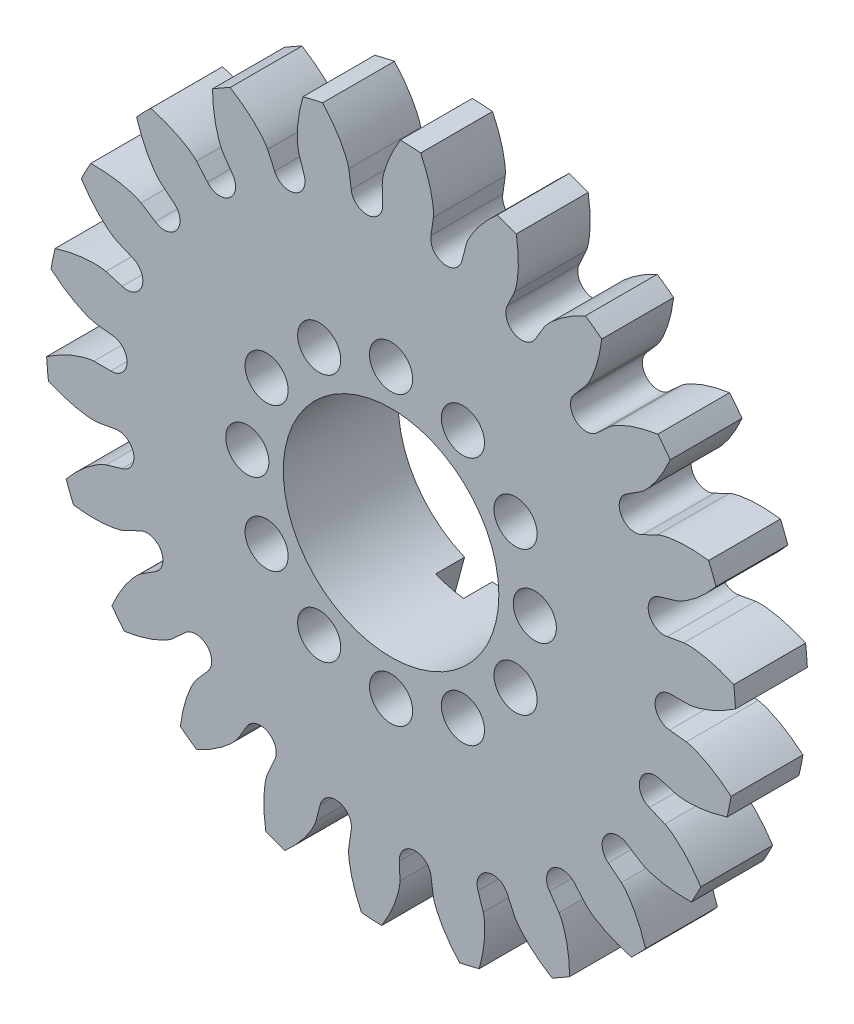
from build123d import *

# Parameters (mm, degrees)
SKETCH_1_W               = 5
SKETCH_1_H               = 10
SKETCH_6_R               = 24
SKETCH_6_R_2             = 17.5
EXTRUDE_1_DEPTH          = 5
CUT_EXTRUDE_2_DEPTH      = 35.307433597
PATTERN_CIRCULAR_1_COUNT = 22
MIRROR_1_COPY_1_DEPTH    = 35.307433597
MIRROR_1_COPY_2_DEPTH    = 35.307433597
MIRROR_1_COPY_3_DEPTH    = 35.307433597
MIRROR_1_COPY_4_DEPTH    = 35.307433597
MIRROR_1_COPY_5_DEPTH    = 35.307433597
MIRROR_1_COPY_6_DEPTH    = 35.307433597
MIRROR_1_COPY_7_DEPTH    = 35.307433597
MIRROR_1_COPY_8_DEPTH    = 35.307433597
MIRROR_1_COPY_9_DEPTH    = 35.307433597
MIRROR_1_COPY_10_DEPTH   = 35.307433597
MIRROR_1_COPY_11_DEPTH   = 35.307433597
MIRROR_1_COPY_12_DEPTH   = 35.307433597
MIRROR_1_COPY_13_DEPTH   = 35.307433597
MIRROR_1_COPY_14_DEPTH   = 35.307433597
MIRROR_1_COPY_15_DEPTH   = 35.307433597
MIRROR_1_COPY_16_DEPTH   = 35.307433597
MIRROR_1_COPY_17_DEPTH   = 35.307433597
MIRROR_1_COPY_18_DEPTH   = 35.307433597
MIRROR_1_COPY_19_DEPTH   = 35.307433597
MIRROR_1_COPY_20_DEPTH   = 35.307433597
MIRROR_1_COPY_21_DEPTH   = 35.307433597
SKETCH_8_R               = 1.101508708
CUT_EXTRUDE_3_DEPTH      = 35.274127733
PATTERN_CIRCULAR_2_COUNT = 22
EXTRUDE_START            = 3
SKETCH_10_R              = 12.5
SKETCH_10_R_2            = 7.5
EXTRUDE_2_DEPTH          = 3
SKETCH_11_R              = 1.5
CUT_EXTRUDE_5_DEPTH      = 35.838424632
SKETCH_12_R              = 16.5
SKETCH_12_R_2            = 12.5
CUT_EXTRUDE_6_DEPTH      = 3
CUT_EXTRUDE_7_DEPTH      = 2


with BuildPart() as part:
    # ｽｹｯﾁ1 → 回転1 (revolve)
    with BuildSketch(Plane(origin=(0, 0, 0), x_dir=(0, 0, -1), z_dir=(1, 0, 0)), mode=Mode.PRIVATE) as revolve_1_sk:
        with Locations((2.5, 12.5)):
            Rectangle(SKETCH_1_W, SKETCH_1_H)
    revolve(revolve_1_sk.sketch.rotate(Axis((0, 0, 0), (0, 0, -1)), 90), axis=Axis((0, 0, 0), (0, 0, -1)))

    # ｽｹｯﾁ6 → ﾎﾞｽ - 押し出し1 (add, through all)
    with BuildSketch(Plane.XY):
        Circle(SKETCH_6_R)
        Circle(SKETCH_6_R_2, mode=Mode.SUBTRACT)
    extrude(amount=-EXTRUDE_1_DEPTH)

    # ｽｹｯﾁ7 → ｶｯﾄ - 押し出し2 (cut, through all)
    with BuildSketch(Plane.XY):
        with BuildLine():
            Line((19.5, 0), (20.673237657, 0))
            add(Edge.make_bspline(
                [(20.673237657, 0), (20.705097618, 0.001016279), (20.76868666, 0.004953572), (20.946306576, 0.025954943), (21.280946336, 0.091618095), (21.783663359, 0.236162746), (22.452216157, 0.500283619), (23.095599061, 0.825426896), (23.575034854, 1.111479717), (23.863802108, 1.299385731), (23.961177482, 1.364541562)],
                knots=[0, 0, 0, 0, 0, 0.002802036, 0.005604071, 0.015718253, 0.029959921, 0.048733673, 0.068727069, 0.079031375, 0.079031375, 0.079031375, 0.079031375, 0.079031375], degree=4))
            ThreePointArc((23.961177482, 1.364541562), (23.99999954, 0.004697234), (23.961709777, -1.355162186))
            Line((23.961709777, -1.355162186), (19.468889194, -1.101069276))
            ThreePointArc((19.468889194, -1.101069276), (19.492220747, -0.550754354), (19.5, 0))
        make_face()
    cut_extrude_2 = extrude(amount=-CUT_EXTRUDE_2_DEPTH, mode=Mode.SUBTRACT)

    # 円形ﾊﾟﾀｰﾝ1: ｶｯﾄ - 押し出し2 ×22 about axis
    pattern_circular_1_axis = Axis((0, 0, 0), (0, 0, 1))
    for i in range(1, PATTERN_CIRCULAR_1_COUNT):
        add(cut_extrude_2.rotate(pattern_circular_1_axis, i * 360 / PATTERN_CIRCULAR_1_COUNT), mode=Mode.SUBTRACT)

    # ﾐﾗｰ1: ｶｯﾄ - 押し出し2 across plane
    add(cut_extrude_2.mirror(Plane(origin=(19.468889194, -1.101069276, -5), x_dir=(0, 0, 1), z_dir=(-0.05646509109013372, -0.9984045740521139, 0))), mode=Mode.SUBTRACT)

    # ﾐﾗｰ1 copy 1 sketch → ﾐﾗｰ1 copy 1 (cut, through all)
    with BuildSketch(Plane(origin=(0, 0, 0), x_dir=(0.9216093094984582, -0.38811890013986033, 0), z_dir=(0, 0, 1))):
        with BuildLine():
            Line((19.5, 0), (20.673237657, 0))
            add(Edge.make_bspline(
                [(20.673237657, 0), (20.705097618, -0.001016279), (20.76868666, -0.004953572), (20.946306576, -0.025954943), (21.280946336, -0.091618095), (21.783663359, -0.236162746), (22.452216157, -0.500283619), (23.095599061, -0.825426896), (23.575034854, -1.111479717), (23.863802108, -1.299385731), (23.961177482, -1.364541562)],
                knots=[0, 0, 0, 0, 0, 0.002802036, 0.005604071, 0.015718253, 0.029959921, 0.048733673, 0.068727069, 0.079031375, 0.079031375, 0.079031375, 0.079031375, 0.079031375], degree=4))
            ThreePointArc((23.961177482, -1.364541562), (23.99999954, -0.004697234), (23.961709777, 1.355162186))
            Line((23.961709777, 1.355162186), (19.468889194, 1.101069276))
            ThreePointArc((19.468889194, 1.101069276), (19.492220747, 0.550754354), (19.5, 0))
        make_face()
    extrude(amount=-MIRROR_1_COPY_1_DEPTH, mode=Mode.SUBTRACT)

    # ﾐﾗｰ1 copy 2 sketch → ﾐﾗｰ1 copy 2 (cut, through all)
    with BuildSketch(Plane(origin=(0, 0, 0), x_dir=(0.7749319267865931, -0.632044704785048, 0), z_dir=(0, 0, 1))):
        with BuildLine():
            Line((19.5, 0), (20.673237657, 0))
            add(Edge.make_bspline(
                [(20.673237657, 0), (20.705097618, -0.001016279), (20.76868666, -0.004953572), (20.946306576, -0.025954943), (21.280946336, -0.091618095), (21.783663359, -0.236162746), (22.452216157, -0.500283619), (23.095599061, -0.825426896), (23.575034854, -1.111479717), (23.863802108, -1.299385731), (23.961177482, -1.364541562)],
                knots=[0, 0, 0, 0, 0, 0.002802036, 0.005604071, 0.015718253, 0.029959921, 0.048733673, 0.068727069, 0.079031375, 0.079031375, 0.079031375, 0.079031375, 0.079031375], degree=4))
            ThreePointArc((23.961177482, -1.364541562), (23.99999954, -0.004697234), (23.961709777, 1.355162186))
            Line((23.961709777, 1.355162186), (19.468889194, 1.101069276))
            ThreePointArc((19.468889194, 1.101069276), (19.492220747, 0.550754354), (19.5, 0))
        make_face()
    extrude(amount=-MIRROR_1_COPY_2_DEPTH, mode=Mode.SUBTRACT)

    # ﾐﾗｰ1 copy 3 sketch → ﾐﾗｰ1 copy 3 (cut, through all)
    with BuildSketch(Plane(origin=(0, 0, 0), x_dir=(0.5654741680641019, -0.8247660063631453, 0), z_dir=(0, 0, 1))):
        with BuildLine():
            Line((19.5, 0), (20.673237657, 0))
            add(Edge.make_bspline(
                [(20.673237657, 0), (20.705097618, -0.001016279), (20.76868666, -0.004953572), (20.946306576, -0.025954943), (21.280946336, -0.091618095), (21.783663359, -0.236162746), (22.452216157, -0.500283619), (23.095599061, -0.825426896), (23.575034854, -1.111479717), (23.863802108, -1.299385731), (23.961177482, -1.364541562)],
                knots=[0, 0, 0, 0, 0, 0.002802036, 0.005604071, 0.015718253, 0.029959921, 0.048733673, 0.068727069, 0.079031375, 0.079031375, 0.079031375, 0.079031375, 0.079031375], degree=4))
            ThreePointArc((23.961177482, -1.364541562), (23.99999954, -0.004697234), (23.961709777, 1.355162186))
            Line((23.961709777, 1.355162186), (19.468889194, 1.101069276))
            ThreePointArc((19.468889194, 1.101069276), (19.492220747, 0.550754354), (19.5, 0))
        make_face()
    extrude(amount=-MIRROR_1_COPY_3_DEPTH, mode=Mode.SUBTRACT)

    # ﾐﾗｰ1 copy 4 sketch → ﾐﾗｰ1 copy 4 (cut, through all)
    with BuildSketch(Plane(origin=(0, 0, 0), x_dir=(0.3102050552494255, -0.9506696711780076, 0), z_dir=(0, 0, 1))):
        with BuildLine():
            Line((19.5, 0), (20.673237657, 0))
            add(Edge.make_bspline(
                [(20.673237657, 0), (20.705097618, -0.001016279), (20.76868666, -0.004953572), (20.946306576, -0.025954943), (21.280946336, -0.091618095), (21.783663359, -0.236162746), (22.452216157, -0.500283619), (23.095599061, -0.825426896), (23.575034854, -1.111479717), (23.863802108, -1.299385731), (23.961177482, -1.364541562)],
                knots=[0, 0, 0, 0, 0, 0.002802036, 0.005604071, 0.015718253, 0.029959921, 0.048733673, 0.068727069, 0.079031375, 0.079031375, 0.079031375, 0.079031375, 0.079031375], degree=4))
            ThreePointArc((23.961177482, -1.364541562), (23.99999954, -0.004697234), (23.961709777, 1.355162186))
            Line((23.961709777, 1.355162186), (19.468889194, 1.101069276))
            ThreePointArc((19.468889194, 1.101069276), (19.492220747, 0.550754354), (19.5, 0))
        make_face()
    extrude(amount=-MIRROR_1_COPY_4_DEPTH, mode=Mode.SUBTRACT)

    # ﾐﾗｰ1 copy 5 sketch → ﾐﾗｰ1 copy 5 (cut, through all)
    with BuildSketch(Plane(origin=(0, 0, 0), x_dir=(0.029804973718939642, -0.9995557330842606, 0), z_dir=(0, 0, 1))):
        with BuildLine():
            Line((19.5, 0), (20.673237657, 0))
            add(Edge.make_bspline(
                [(20.673237657, 0), (20.705097618, -0.001016279), (20.76868666, -0.004953572), (20.946306576, -0.025954943), (21.280946336, -0.091618095), (21.783663359, -0.236162746), (22.452216157, -0.500283619), (23.095599061, -0.825426896), (23.575034854, -1.111479717), (23.863802108, -1.299385731), (23.961177482, -1.364541562)],
                knots=[0, 0, 0, 0, 0, 0.002802036, 0.005604071, 0.015718253, 0.029959921, 0.048733673, 0.068727069, 0.079031375, 0.079031375, 0.079031375, 0.079031375, 0.079031375], degree=4))
            ThreePointArc((23.961177482, -1.364541562), (23.99999954, -0.004697234), (23.961709777, 1.355162186))
            Line((23.961709777, 1.355162186), (19.468889194, 1.101069276))
            ThreePointArc((19.468889194, 1.101069276), (19.492220747, 0.550754354), (19.5, 0))
        make_face()
    extrude(amount=-MIRROR_1_COPY_5_DEPTH, mode=Mode.SUBTRACT)

    # ﾐﾗｰ1 copy 6 sketch → ﾐﾗｰ1 copy 6 (cut, through all)
    with BuildSketch(Plane(origin=(0, 0, 0), x_dir=(-0.25300972952525125, -0.9674637340828645, 0), z_dir=(0, 0, 1))):
        with BuildLine():
            Line((19.5, 0), (20.673237657, 0))
            add(Edge.make_bspline(
                [(20.673237657, 0), (20.705097618, -0.001016279), (20.76868666, -0.004953572), (20.946306576, -0.025954943), (21.280946336, -0.091618095), (21.783663359, -0.236162746), (22.452216157, -0.500283619), (23.095599061, -0.825426896), (23.575034854, -1.111479717), (23.863802108, -1.299385731), (23.961177482, -1.364541562)],
                knots=[0, 0, 0, 0, 0, 0.002802036, 0.005604071, 0.015718253, 0.029959921, 0.048733673, 0.068727069, 0.079031375, 0.079031375, 0.079031375, 0.079031375, 0.079031375], degree=4))
            ThreePointArc((23.961177482, -1.364541562), (23.99999954, -0.004697234), (23.961709777, 1.355162186))
            Line((23.961709777, 1.355162186), (19.468889194, 1.101069276))
            ThreePointArc((19.468889194, 1.101069276), (19.492220747, 0.550754354), (19.5, 0))
        make_face()
    extrude(amount=-MIRROR_1_COPY_6_DEPTH, mode=Mode.SUBTRACT)

    # ﾐﾗｰ1 copy 7 sketch → ﾐﾗｰ1 copy 7 (cut, through all)
    with BuildSketch(Plane(origin=(0, 0, 0), x_dir=(-0.5153270891901053, -0.8569935770744456, 0), z_dir=(0, 0, 1))):
        with BuildLine():
            Line((19.5, 0), (20.673237657, 0))
            add(Edge.make_bspline(
                [(20.673237657, 0), (20.705097618, -0.001016279), (20.76868666, -0.004953572), (20.946306576, -0.025954943), (21.280946336, -0.091618095), (21.783663359, -0.236162746), (22.452216157, -0.500283619), (23.095599061, -0.825426896), (23.575034854, -1.111479717), (23.863802108, -1.299385731), (23.961177482, -1.364541562)],
                knots=[0, 0, 0, 0, 0, 0.002802036, 0.005604071, 0.015718253, 0.029959921, 0.048733673, 0.068727069, 0.079031375, 0.079031375, 0.079031375, 0.079031375, 0.079031375], degree=4))
            ThreePointArc((23.961177482, -1.364541562), (23.99999954, -0.004697234), (23.961709777, 1.355162186))
            Line((23.961709777, 1.355162186), (19.468889194, 1.101069276))
            ThreePointArc((19.468889194, 1.101069276), (19.492220747, 0.550754354), (19.5, 0))
        make_face()
    extrude(amount=-MIRROR_1_COPY_7_DEPTH, mode=Mode.SUBTRACT)

    # ﾐﾗｰ1 copy 8 sketch → ﾐﾗｰ1 copy 8 (cut, through all)
    with BuildSketch(Plane(origin=(0, 0, 0), x_dir=(-0.7358957128569837, -0.6770948971885048, 0), z_dir=(0, 0, 1))):
        with BuildLine():
            Line((19.5, 0), (20.673237657, 0))
            add(Edge.make_bspline(
                [(20.673237657, 0), (20.705097618, -0.001016279), (20.76868666, -0.004953572), (20.946306576, -0.025954943), (21.280946336, -0.091618095), (21.783663359, -0.236162746), (22.452216157, -0.500283619), (23.095599061, -0.825426896), (23.575034854, -1.111479717), (23.863802108, -1.299385731), (23.961177482, -1.364541562)],
                knots=[0, 0, 0, 0, 0, 0.002802036, 0.005604071, 0.015718253, 0.029959921, 0.048733673, 0.068727069, 0.079031375, 0.079031375, 0.079031375, 0.079031375, 0.079031375], degree=4))
            ThreePointArc((23.961177482, -1.364541562), (23.99999954, -0.004697234), (23.961709777, 1.355162186))
            Line((23.961709777, 1.355162186), (19.468889194, 1.101069276))
            ThreePointArc((19.468889194, 1.101069276), (19.492220747, 0.550754354), (19.5, 0))
        make_face()
    extrude(amount=-MIRROR_1_COPY_8_DEPTH, mode=Mode.SUBTRACT)

    # ﾐﾗｰ1 copy 9 sketch → ﾐﾗｰ1 copy 9 (cut, through all)
    with BuildSketch(Plane(origin=(0, 0, 0), x_dir=(-0.8968464424085102, -0.44234201557075603, 0), z_dir=(0, 0, 1))):
        with BuildLine():
            Line((19.5, 0), (20.673237657, 0))
            add(Edge.make_bspline(
                [(20.673237657, 0), (20.705097618, -0.001016279), (20.76868666, -0.004953572), (20.946306576, -0.025954943), (21.280946336, -0.091618095), (21.783663359, -0.236162746), (22.452216157, -0.500283619), (23.095599061, -0.825426896), (23.575034854, -1.111479717), (23.863802108, -1.299385731), (23.961177482, -1.364541562)],
                knots=[0, 0, 0, 0, 0, 0.002802036, 0.005604071, 0.015718253, 0.029959921, 0.048733673, 0.068727069, 0.079031375, 0.079031375, 0.079031375, 0.079031375, 0.079031375], degree=4))
            ThreePointArc((23.961177482, -1.364541562), (23.99999954, -0.004697234), (23.961709777, 1.355162186))
            Line((23.961709777, 1.355162186), (19.468889194, 1.101069276))
            ThreePointArc((19.468889194, 1.101069276), (19.492220747, 0.550754354), (19.5, 0))
        make_face()
    extrude(amount=-MIRROR_1_COPY_9_DEPTH, mode=Mode.SUBTRACT)

    # ﾐﾗｰ1 copy 10 sketch → ﾐﾗｰ1 copy 10 (cut, through all)
    with BuildSketch(Plane(origin=(0, 0, 0), x_dir=(-0.9851400069472649, -0.1717532145607259, 0), z_dir=(0, 0, 1))):
        with BuildLine():
            Line((19.5, 0), (20.673237657, 0))
            add(Edge.make_bspline(
                [(20.673237657, 0), (20.705097618, -0.001016279), (20.76868666, -0.004953572), (20.946306576, -0.025954943), (21.280946336, -0.091618095), (21.783663359, -0.236162746), (22.452216157, -0.500283619), (23.095599061, -0.825426896), (23.575034854, -1.111479717), (23.863802108, -1.299385731), (23.961177482, -1.364541562)],
                knots=[0, 0, 0, 0, 0, 0.002802036, 0.005604071, 0.015718253, 0.029959921, 0.048733673, 0.068727069, 0.079031375, 0.079031375, 0.079031375, 0.079031375, 0.079031375], degree=4))
            ThreePointArc((23.961177482, -1.364541562), (23.99999954, -0.004697234), (23.961709777, 1.355162186))
            Line((23.961709777, 1.355162186), (19.468889194, 1.101069276))
            ThreePointArc((19.468889194, 1.101069276), (19.492220747, 0.550754354), (19.5, 0))
        make_face()
    extrude(amount=-MIRROR_1_COPY_10_DEPTH, mode=Mode.SUBTRACT)

    # ﾐﾗｰ1 copy 11 sketch → ﾐﾗｰ1 copy 11 (cut, through all)
    with BuildSketch(Plane(origin=(0, 0, 0), x_dir=(-0.9936233869763658, 0.11275001043731742, 0), z_dir=(0, 0, 1))):
        with BuildLine():
            Line((19.5, 0), (20.673237657, 0))
            add(Edge.make_bspline(
                [(20.673237657, 0), (20.705097618, -0.001016279), (20.76868666, -0.004953572), (20.946306576, -0.025954943), (21.280946336, -0.091618095), (21.783663359, -0.236162746), (22.452216157, -0.500283619), (23.095599061, -0.825426896), (23.575034854, -1.111479717), (23.863802108, -1.299385731), (23.961177482, -1.364541562)],
                knots=[0, 0, 0, 0, 0, 0.002802036, 0.005604071, 0.015718253, 0.029959921, 0.048733673, 0.068727069, 0.079031375, 0.079031375, 0.079031375, 0.079031375, 0.079031375], degree=4))
            ThreePointArc((23.961177482, -1.364541562), (23.99999954, -0.004697234), (23.961709777, 1.355162186))
            Line((23.961709777, 1.355162186), (19.468889194, 1.101069276))
            ThreePointArc((19.468889194, 1.101069276), (19.492220747, 0.550754354), (19.5, 0))
        make_face()
    extrude(amount=-MIRROR_1_COPY_11_DEPTH, mode=Mode.SUBTRACT)

    # ﾐﾗｰ1 copy 12 sketch → ﾐﾗｰ1 copy 12 (cut, through all)
    with BuildSketch(Plane(origin=(0, 0, 0), x_dir=(-0.9216093094984582, 0.3881189001398605, 0), z_dir=(0, 0, 1))):
        with BuildLine():
            Line((19.5, 0), (20.673237657, 0))
            add(Edge.make_bspline(
                [(20.673237657, 0), (20.705097618, -0.001016279), (20.76868666, -0.004953572), (20.946306576, -0.025954943), (21.280946336, -0.091618095), (21.783663359, -0.236162746), (22.452216157, -0.500283619), (23.095599061, -0.825426896), (23.575034854, -1.111479717), (23.863802108, -1.299385731), (23.961177482, -1.364541562)],
                knots=[0, 0, 0, 0, 0, 0.002802036, 0.005604071, 0.015718253, 0.029959921, 0.048733673, 0.068727069, 0.079031375, 0.079031375, 0.079031375, 0.079031375, 0.079031375], degree=4))
            ThreePointArc((23.961177482, -1.364541562), (23.99999954, -0.004697234), (23.961709777, 1.355162186))
            Line((23.961709777, 1.355162186), (19.468889194, 1.101069276))
            ThreePointArc((19.468889194, 1.101069276), (19.492220747, 0.550754354), (19.5, 0))
        make_face()
    extrude(amount=-MIRROR_1_COPY_12_DEPTH, mode=Mode.SUBTRACT)

    # ﾐﾗｰ1 copy 13 sketch → ﾐﾗｰ1 copy 13 (cut, through all)
    with BuildSketch(Plane(origin=(0, 0, 0), x_dir=(-0.7749319267865931, 0.632044704785048, 0), z_dir=(0, 0, 1))):
        with BuildLine():
            Line((19.5, 0), (20.673237657, 0))
            add(Edge.make_bspline(
                [(20.673237657, 0), (20.705097618, -0.001016279), (20.76868666, -0.004953572), (20.946306576, -0.025954943), (21.280946336, -0.091618095), (21.783663359, -0.236162746), (22.452216157, -0.500283619), (23.095599061, -0.825426896), (23.575034854, -1.111479717), (23.863802108, -1.299385731), (23.961177482, -1.364541562)],
                knots=[0, 0, 0, 0, 0, 0.002802036, 0.005604071, 0.015718253, 0.029959921, 0.048733673, 0.068727069, 0.079031375, 0.079031375, 0.079031375, 0.079031375, 0.079031375], degree=4))
            ThreePointArc((23.961177482, -1.364541562), (23.99999954, -0.004697234), (23.961709777, 1.355162186))
            Line((23.961709777, 1.355162186), (19.468889194, 1.101069276))
            ThreePointArc((19.468889194, 1.101069276), (19.492220747, 0.550754354), (19.5, 0))
        make_face()
    extrude(amount=-MIRROR_1_COPY_13_DEPTH, mode=Mode.SUBTRACT)

    # ﾐﾗｰ1 copy 14 sketch → ﾐﾗｰ1 copy 14 (cut, through all)
    with BuildSketch(Plane(origin=(0, 0, 0), x_dir=(-0.5654741680641021, 0.8247660063631452, 0), z_dir=(0, 0, 1))):
        with BuildLine():
            Line((19.5, 0), (20.673237657, 0))
            add(Edge.make_bspline(
                [(20.673237657, 0), (20.705097618, -0.001016279), (20.76868666, -0.004953572), (20.946306576, -0.025954943), (21.280946336, -0.091618095), (21.783663359, -0.236162746), (22.452216157, -0.500283619), (23.095599061, -0.825426896), (23.575034854, -1.111479717), (23.863802108, -1.299385731), (23.961177482, -1.364541562)],
                knots=[0, 0, 0, 0, 0, 0.002802036, 0.005604071, 0.015718253, 0.029959921, 0.048733673, 0.068727069, 0.079031375, 0.079031375, 0.079031375, 0.079031375, 0.079031375], degree=4))
            ThreePointArc((23.961177482, -1.364541562), (23.99999954, -0.004697234), (23.961709777, 1.355162186))
            Line((23.961709777, 1.355162186), (19.468889194, 1.101069276))
            ThreePointArc((19.468889194, 1.101069276), (19.492220747, 0.550754354), (19.5, 0))
        make_face()
    extrude(amount=-MIRROR_1_COPY_14_DEPTH, mode=Mode.SUBTRACT)

    # ﾐﾗｰ1 copy 15 sketch → ﾐﾗｰ1 copy 15 (cut, through all)
    with BuildSketch(Plane(origin=(0, 0, 0), x_dir=(-0.31020505524942543, 0.9506696711780077, 0), z_dir=(0, 0, 1))):
        with BuildLine():
            Line((19.5, 0), (20.673237657, 0))
            add(Edge.make_bspline(
                [(20.673237657, 0), (20.705097618, -0.001016279), (20.76868666, -0.004953572), (20.946306576, -0.025954943), (21.280946336, -0.091618095), (21.783663359, -0.236162746), (22.452216157, -0.500283619), (23.095599061, -0.825426896), (23.575034854, -1.111479717), (23.863802108, -1.299385731), (23.961177482, -1.364541562)],
                knots=[0, 0, 0, 0, 0, 0.002802036, 0.005604071, 0.015718253, 0.029959921, 0.048733673, 0.068727069, 0.079031375, 0.079031375, 0.079031375, 0.079031375, 0.079031375], degree=4))
            ThreePointArc((23.961177482, -1.364541562), (23.99999954, -0.004697234), (23.961709777, 1.355162186))
            Line((23.961709777, 1.355162186), (19.468889194, 1.101069276))
            ThreePointArc((19.468889194, 1.101069276), (19.492220747, 0.550754354), (19.5, 0))
        make_face()
    extrude(amount=-MIRROR_1_COPY_15_DEPTH, mode=Mode.SUBTRACT)

    # ﾐﾗｰ1 copy 16 sketch → ﾐﾗｰ1 copy 16 (cut, through all)
    with BuildSketch(Plane(origin=(0, 0, 0), x_dir=(-0.02980497371893953, 0.9995557330842606, 0), z_dir=(0, 0, 1))):
        with BuildLine():
            Line((19.5, 0), (20.673237657, 0))
            add(Edge.make_bspline(
                [(20.673237657, 0), (20.705097618, -0.001016279), (20.76868666, -0.004953572), (20.946306576, -0.025954943), (21.280946336, -0.091618095), (21.783663359, -0.236162746), (22.452216157, -0.500283619), (23.095599061, -0.825426896), (23.575034854, -1.111479717), (23.863802108, -1.299385731), (23.961177482, -1.364541562)],
                knots=[0, 0, 0, 0, 0, 0.002802036, 0.005604071, 0.015718253, 0.029959921, 0.048733673, 0.068727069, 0.079031375, 0.079031375, 0.079031375, 0.079031375, 0.079031375], degree=4))
            ThreePointArc((23.961177482, -1.364541562), (23.99999954, -0.004697234), (23.961709777, 1.355162186))
            Line((23.961709777, 1.355162186), (19.468889194, 1.101069276))
            ThreePointArc((19.468889194, 1.101069276), (19.492220747, 0.550754354), (19.5, 0))
        make_face()
    extrude(amount=-MIRROR_1_COPY_16_DEPTH, mode=Mode.SUBTRACT)

    # ﾐﾗｰ1 copy 17 sketch → ﾐﾗｰ1 copy 17 (cut, through all)
    with BuildSketch(Plane(origin=(0, 0, 0), x_dir=(0.2530097295252509, 0.9674637340828646, 0), z_dir=(0, 0, 1))):
        with BuildLine():
            Line((19.5, 0), (20.673237657, 0))
            add(Edge.make_bspline(
                [(20.673237657, 0), (20.705097618, -0.001016279), (20.76868666, -0.004953572), (20.946306576, -0.025954943), (21.280946336, -0.091618095), (21.783663359, -0.236162746), (22.452216157, -0.500283619), (23.095599061, -0.825426896), (23.575034854, -1.111479717), (23.863802108, -1.299385731), (23.961177482, -1.364541562)],
                knots=[0, 0, 0, 0, 0, 0.002802036, 0.005604071, 0.015718253, 0.029959921, 0.048733673, 0.068727069, 0.079031375, 0.079031375, 0.079031375, 0.079031375, 0.079031375], degree=4))
            ThreePointArc((23.961177482, -1.364541562), (23.99999954, -0.004697234), (23.961709777, 1.355162186))
            Line((23.961709777, 1.355162186), (19.468889194, 1.101069276))
            ThreePointArc((19.468889194, 1.101069276), (19.492220747, 0.550754354), (19.5, 0))
        make_face()
    extrude(amount=-MIRROR_1_COPY_17_DEPTH, mode=Mode.SUBTRACT)

    # ﾐﾗｰ1 copy 18 sketch → ﾐﾗｰ1 copy 18 (cut, through all)
    with BuildSketch(Plane(origin=(0, 0, 0), x_dir=(0.5153270891901057, 0.8569935770744452, 0), z_dir=(0, 0, 1))):
        with BuildLine():
            Line((19.5, 0), (20.673237657, 0))
            add(Edge.make_bspline(
                [(20.673237657, 0), (20.705097618, -0.001016279), (20.76868666, -0.004953572), (20.946306576, -0.025954943), (21.280946336, -0.091618095), (21.783663359, -0.236162746), (22.452216157, -0.500283619), (23.095599061, -0.825426896), (23.575034854, -1.111479717), (23.863802108, -1.299385731), (23.961177482, -1.364541562)],
                knots=[0, 0, 0, 0, 0, 0.002802036, 0.005604071, 0.015718253, 0.029959921, 0.048733673, 0.068727069, 0.079031375, 0.079031375, 0.079031375, 0.079031375, 0.079031375], degree=4))
            ThreePointArc((23.961177482, -1.364541562), (23.99999954, -0.004697234), (23.961709777, 1.355162186))
            Line((23.961709777, 1.355162186), (19.468889194, 1.101069276))
            ThreePointArc((19.468889194, 1.101069276), (19.492220747, 0.550754354), (19.5, 0))
        make_face()
    extrude(amount=-MIRROR_1_COPY_18_DEPTH, mode=Mode.SUBTRACT)

    # ﾐﾗｰ1 copy 19 sketch → ﾐﾗｰ1 copy 19 (cut, through all)
    with BuildSketch(Plane(origin=(0, 0, 0), x_dir=(0.7358957128569833, 0.6770948971885052, 0), z_dir=(0, 0, 1))):
        with BuildLine():
            Line((19.5, 0), (20.673237657, 0))
            add(Edge.make_bspline(
                [(20.673237657, 0), (20.705097618, -0.001016279), (20.76868666, -0.004953572), (20.946306576, -0.025954943), (21.280946336, -0.091618095), (21.783663359, -0.236162746), (22.452216157, -0.500283619), (23.095599061, -0.825426896), (23.575034854, -1.111479717), (23.863802108, -1.299385731), (23.961177482, -1.364541562)],
                knots=[0, 0, 0, 0, 0, 0.002802036, 0.005604071, 0.015718253, 0.029959921, 0.048733673, 0.068727069, 0.079031375, 0.079031375, 0.079031375, 0.079031375, 0.079031375], degree=4))
            ThreePointArc((23.961177482, -1.364541562), (23.99999954, -0.004697234), (23.961709777, 1.355162186))
            Line((23.961709777, 1.355162186), (19.468889194, 1.101069276))
            ThreePointArc((19.468889194, 1.101069276), (19.492220747, 0.550754354), (19.5, 0))
        make_face()
    extrude(amount=-MIRROR_1_COPY_19_DEPTH, mode=Mode.SUBTRACT)

    # ﾐﾗｰ1 copy 20 sketch → ﾐﾗｰ1 copy 20 (cut, through all)
    with BuildSketch(Plane(origin=(0, 0, 0), x_dir=(0.8968464424085097, 0.44234201557075686, 0), z_dir=(0, 0, 1))):
        with BuildLine():
            Line((19.5, 0), (20.673237657, 0))
            add(Edge.make_bspline(
                [(20.673237657, 0), (20.705097618, -0.001016279), (20.76868666, -0.004953572), (20.946306576, -0.025954943), (21.280946336, -0.091618095), (21.783663359, -0.236162746), (22.452216157, -0.500283619), (23.095599061, -0.825426896), (23.575034854, -1.111479717), (23.863802108, -1.299385731), (23.961177482, -1.364541562)],
                knots=[0, 0, 0, 0, 0, 0.002802036, 0.005604071, 0.015718253, 0.029959921, 0.048733673, 0.068727069, 0.079031375, 0.079031375, 0.079031375, 0.079031375, 0.079031375], degree=4))
            ThreePointArc((23.961177482, -1.364541562), (23.99999954, -0.004697234), (23.961709777, 1.355162186))
            Line((23.961709777, 1.355162186), (19.468889194, 1.101069276))
            ThreePointArc((19.468889194, 1.101069276), (19.492220747, 0.550754354), (19.5, 0))
        make_face()
    extrude(amount=-MIRROR_1_COPY_20_DEPTH, mode=Mode.SUBTRACT)

    # ﾐﾗｰ1 copy 21 sketch → ﾐﾗｰ1 copy 21 (cut, through all)
    with BuildSketch(Plane(origin=(0, 0, 0), x_dir=(0.985140006947265, 0.17175321456072562, 0), z_dir=(0, 0, 1))):
        with BuildLine():
            Line((19.5, 0), (20.673237657, 0))
            add(Edge.make_bspline(
                [(20.673237657, 0), (20.705097618, -0.001016279), (20.76868666, -0.004953572), (20.946306576, -0.025954943), (21.280946336, -0.091618095), (21.783663359, -0.236162746), (22.452216157, -0.500283619), (23.095599061, -0.825426896), (23.575034854, -1.111479717), (23.863802108, -1.299385731), (23.961177482, -1.364541562)],
                knots=[0, 0, 0, 0, 0, 0.002802036, 0.005604071, 0.015718253, 0.029959921, 0.048733673, 0.068727069, 0.079031375, 0.079031375, 0.079031375, 0.079031375, 0.079031375], degree=4))
            ThreePointArc((23.961177482, -1.364541562), (23.99999954, -0.004697234), (23.961709777, 1.355162186))
            Line((23.961709777, 1.355162186), (19.468889194, 1.101069276))
            ThreePointArc((19.468889194, 1.101069276), (19.492220747, 0.550754354), (19.5, 0))
        make_face()
    extrude(amount=-MIRROR_1_COPY_21_DEPTH, mode=Mode.SUBTRACT)

    # ｽｹｯﾁ8 → ｶｯﾄ - 押し出し3 (cut, through all)
    with BuildSketch(Plane.XY):
        with Locations((-7.086101015, 18.166925233)):
            Circle(SKETCH_8_R)
    cut_extrude_3 = extrude(amount=-CUT_EXTRUDE_3_DEPTH, mode=Mode.SUBTRACT)

    # 円形ﾊﾟﾀｰﾝ2: ｶｯﾄ - 押し出し3 ×22 about axis
    pattern_circular_2_axis = Axis((0, 0, 0), (0, 0, 1))
    for i in range(1, PATTERN_CIRCULAR_2_COUNT):
        add(cut_extrude_3.rotate(pattern_circular_2_axis, i * 360 / PATTERN_CIRCULAR_2_COUNT), mode=Mode.SUBTRACT)

    # ｽｹｯﾁ10 → ﾎﾞｽ - 押し出し2 (add)
    with BuildSketch(Plane(origin=(0, 0, -5), x_dir=(-1, 0, 0), z_dir=(0, 0, -1)).offset(EXTRUDE_START)):
        with Locations(Location((0, 0, 0), (0, 0, 180))):
            Circle(SKETCH_10_R)
        with Locations(Location((0, 0, 0), (0, 0, 180))):
            Circle(SKETCH_10_R_2, mode=Mode.SUBTRACT)
    extrude(amount=-EXTRUDE_2_DEPTH)

    # ｽｹｯﾁ11 → ｶｯﾄ - 押し出し5 (cut, through all)
    with BuildSketch(Plane.XY):
        with Locations((0, 10)):
            Circle(SKETCH_11_R)
        with Locations((5, 8.660254038)):
            Circle(SKETCH_11_R)
        with Locations((8.660254038, 5)):
            Circle(SKETCH_11_R)
        with Locations((10, 0)):
            Circle(SKETCH_11_R)
        with Locations((8.660254038, -5)):
            Circle(SKETCH_11_R)
        with Locations((5, -8.660254038)):
            Circle(SKETCH_11_R)
        with Locations((0, -10)):
            Circle(SKETCH_11_R)
        with Locations((-5, -8.660254038)):
            Circle(SKETCH_11_R)
        with Locations((-8.660254038, -5)):
            Circle(SKETCH_11_R)
        with Locations((-10, 0)):
            Circle(SKETCH_11_R)
        with Locations((-8.660254038, 5)):
            Circle(SKETCH_11_R)
        with Locations((-5, 8.660254038)):
            Circle(SKETCH_11_R)
    extrude(amount=-CUT_EXTRUDE_5_DEPTH, mode=Mode.SUBTRACT)

    # ｽｹｯﾁ12 → ｶｯﾄ - 押し出し6 (cut)
    with BuildSketch(Plane(origin=(0, 0, -5), x_dir=(-1, 0, 0), z_dir=(0, 0, -1))):
        Circle(SKETCH_12_R)
        Circle(SKETCH_12_R_2, mode=Mode.SUBTRACT)
    extrude(amount=-CUT_EXTRUDE_6_DEPTH, mode=Mode.SUBTRACT)

    # ｽｹｯﾁ13 → ｶｯﾄ - 押し出し7 (cut)
    with BuildSketch(Plane(origin=(0, 0, -8), x_dir=(-1, 0, 0), z_dir=(0, 0, -1))):
        with BuildLine():
            Line((2.269312237, -12.332891874), (-4.20116389, 11.815253784))
            ThreePointArc((-4.20116389, 11.815253784), (-3.494057109, 13.039998655), (-2.269312237, 12.332891874))
            Line((-2.269312237, 12.332891874), (4.20116389, -11.815253784))
            ThreePointArc((4.20116389, -11.815253784), (3.494057109, -13.039998655), (2.269312237, -12.332891874))
        make_face()
    extrude(amount=-CUT_EXTRUDE_7_DEPTH, mode=Mode.SUBTRACT)


solid = part.part
